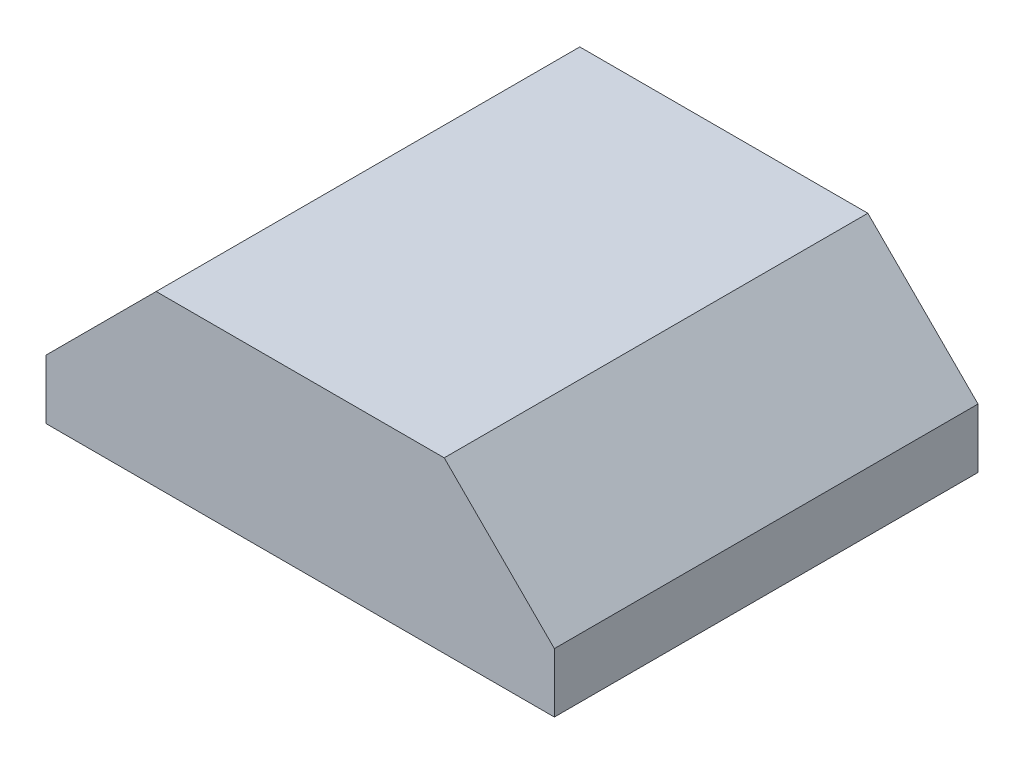
from build123d import *

# Parameters (mm, degrees)
AUFSATZ_LINEAR_AUSTRAGEN1_DEPTH = 10


with BuildPart() as part:
    # Skizze1 → Aufsatz-Linear austragen1 (new body)
    with BuildSketch(Plane.XY):
        Polygon((3.4, 1.808858787), (-3.4, 1.808858787), (-6, -0.791141213), (-6, -2.191141213), (6, -2.191141213), (6, -0.791141213), align=None)
    extrude(amount=AUFSATZ_LINEAR_AUSTRAGEN1_DEPTH)


solid = part.part
